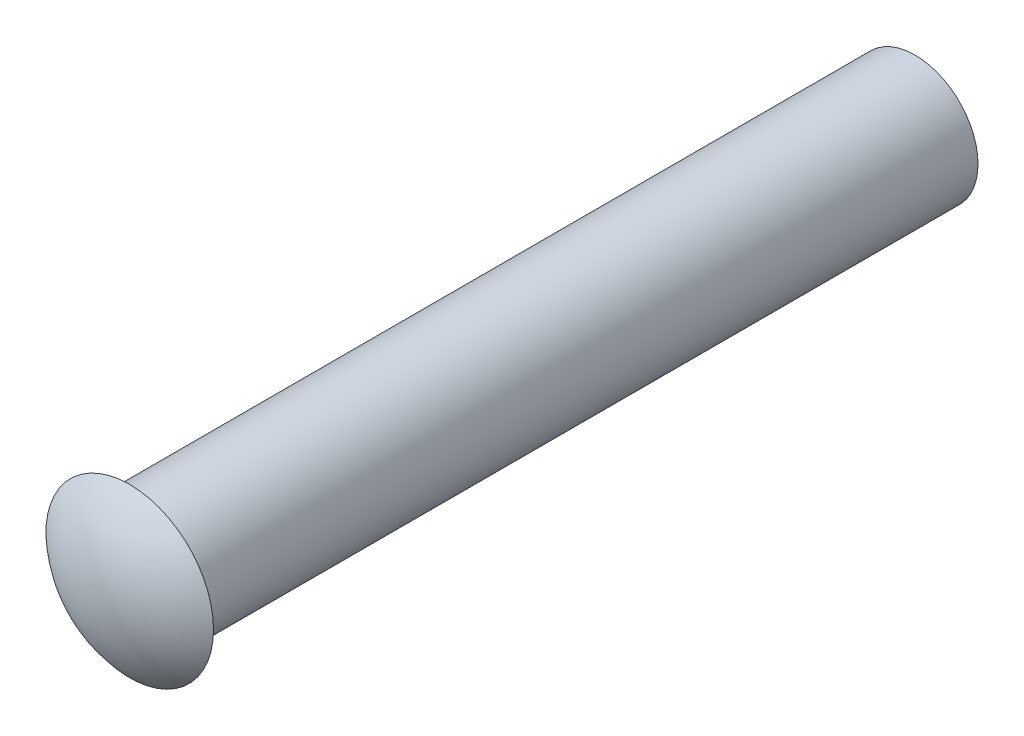
from build123d import *


with BuildPart() as part:
    # Sketch1 → Revolve1 (revolve)
    with BuildSketch(Plane(origin=(0, 0, 0), x_dir=(0, 0, -1), z_dir=(1, 0, 0))):
        with BuildLine():
            Line((0, 0), (19.812, 0))
            Line((19.812, 0), (19.812, 1.524))
            Line((19.812, 1.524), (0.762, 1.524))
            Line((0.762, 1.524), (0.762, 2.032))
            ThreePointArc((0.762, 2.032), (0.196764065, 1.085088476), (0, 0))
        make_face()
    revolve(axis=Axis((0, 0, 0), (0, 0, -1)))


solid = part.part
